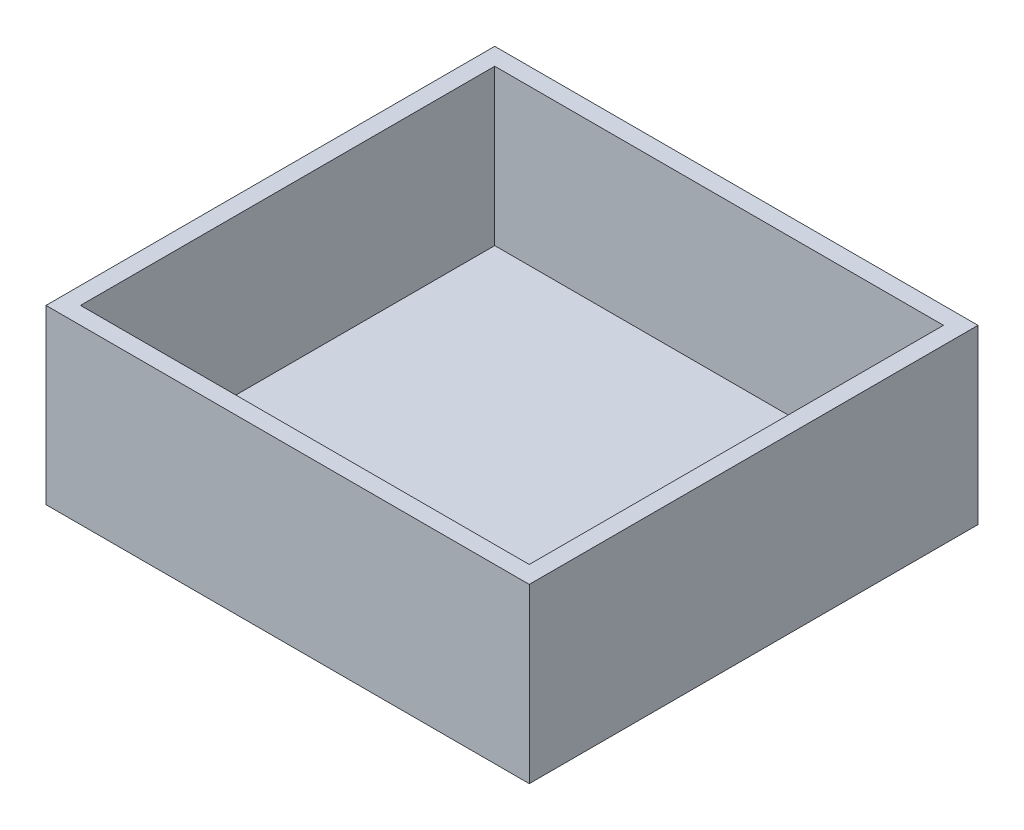
from build123d import *

# Parameters (mm, degrees)
SKETCH_1_W          = 140
SKETCH_1_H          = 130
EXTRUDE_2_DEPTH     = 25
SKETCH_4_W          = 130
SKETCH_4_H          = 120
CUT_EXTRUDE_1_DEPTH = 45


with BuildPart() as part:
    # 草圖1 → 填料-伸長2 (new, symmetric)
    with BuildSketch(Plane(origin=(0, 0, 0), x_dir=(1, 0, 0), z_dir=(0, 1, 0))):
        Rectangle(SKETCH_1_W, SKETCH_1_H)
    extrude(amount=EXTRUDE_2_DEPTH, both=True)

    # 草圖4 → 除料-伸長1 (cut)
    with BuildSketch(Plane(origin=(0, 25, 0), x_dir=(1, 0, 0), z_dir=(0, 1, 0))):
        Rectangle(SKETCH_4_W, SKETCH_4_H)
    extrude(amount=-CUT_EXTRUDE_1_DEPTH, mode=Mode.SUBTRACT)


solid = part.part
